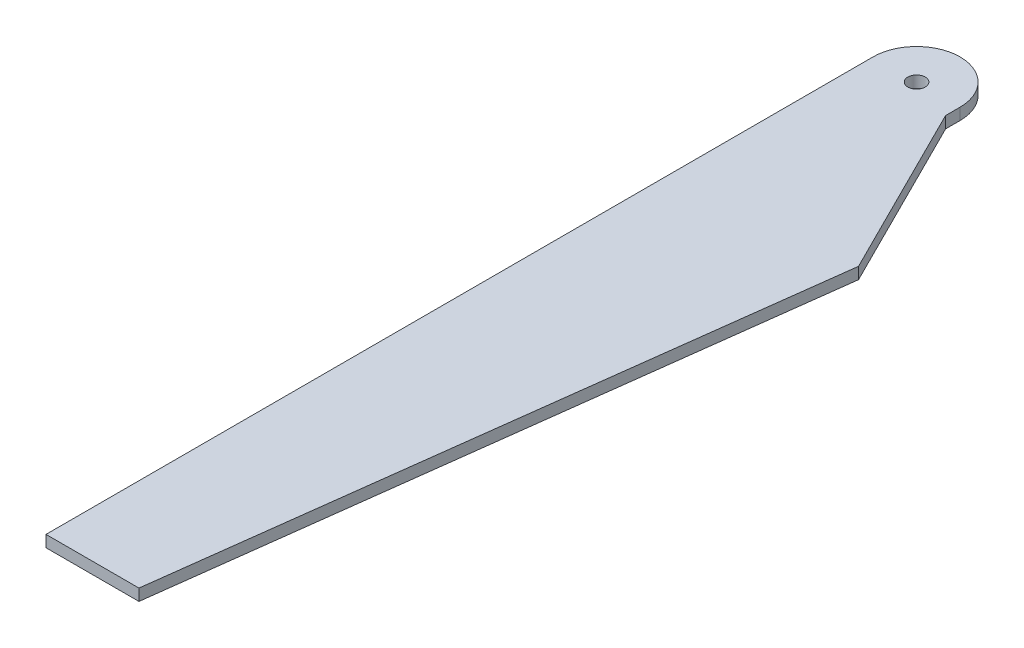
from build123d import *

# Parameters (mm, degrees)
CROQUIS1_R              = 1.5
SALIENTE_EXTRUIR1_DEPTH = 2


with BuildPart() as part:
    # Croquis1 → Saliente-Extruir1 (new body)
    with BuildSketch(Plane(origin=(0, 0, 0), x_dir=(1, 0, 0), z_dir=(0, 1, 0))):
        with BuildLine():
            Line((-30, 79.023809524), (-30, 0))
            Line((-30, 0), (-30, -63.476190476))
            Line((-30, -63.476190476), (-13.983050847, -63.476190476))
            Line((-13.983050847, -63.476190476), (0, 46.523809524))
            Line((0, 46.523809524), (-15, 76.523809524))
            Line((-15, 76.523809524), (-15, 79.023809524))
            ThreePointArc((-15, 79.023809524), (-22.5, 86.523809524), (-30, 79.023809524))
        make_face()
        with Locations(Location((-22.5, 79.023809524, 0), (0, 0, 270))):
            Circle(CROQUIS1_R, mode=Mode.SUBTRACT)
    extrude(amount=SALIENTE_EXTRUIR1_DEPTH)


solid = part.part
